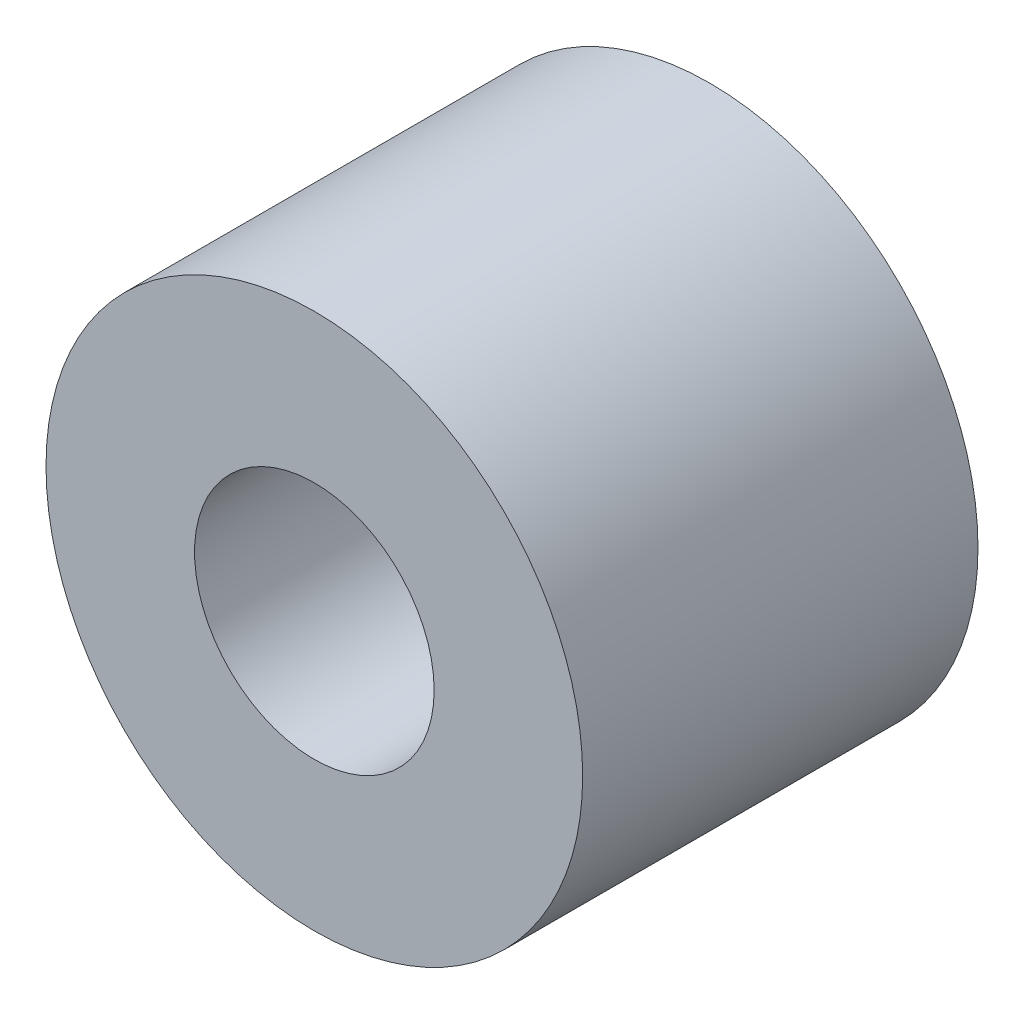
from build123d import *

# Parameters (mm, degrees)
SKETCH1_R           = 14.224
SKETCH1_R_2         = 6.35
BOSS_EXTRUDE1_DEPTH = 20.955


with BuildPart() as part:
    # Sketch1 → Boss-Extrude1 (new body)
    with BuildSketch(Plane.XY):
        Circle(SKETCH1_R)
        Circle(SKETCH1_R_2, mode=Mode.SUBTRACT)
    extrude(amount=BOSS_EXTRUDE1_DEPTH)


solid = part.part
